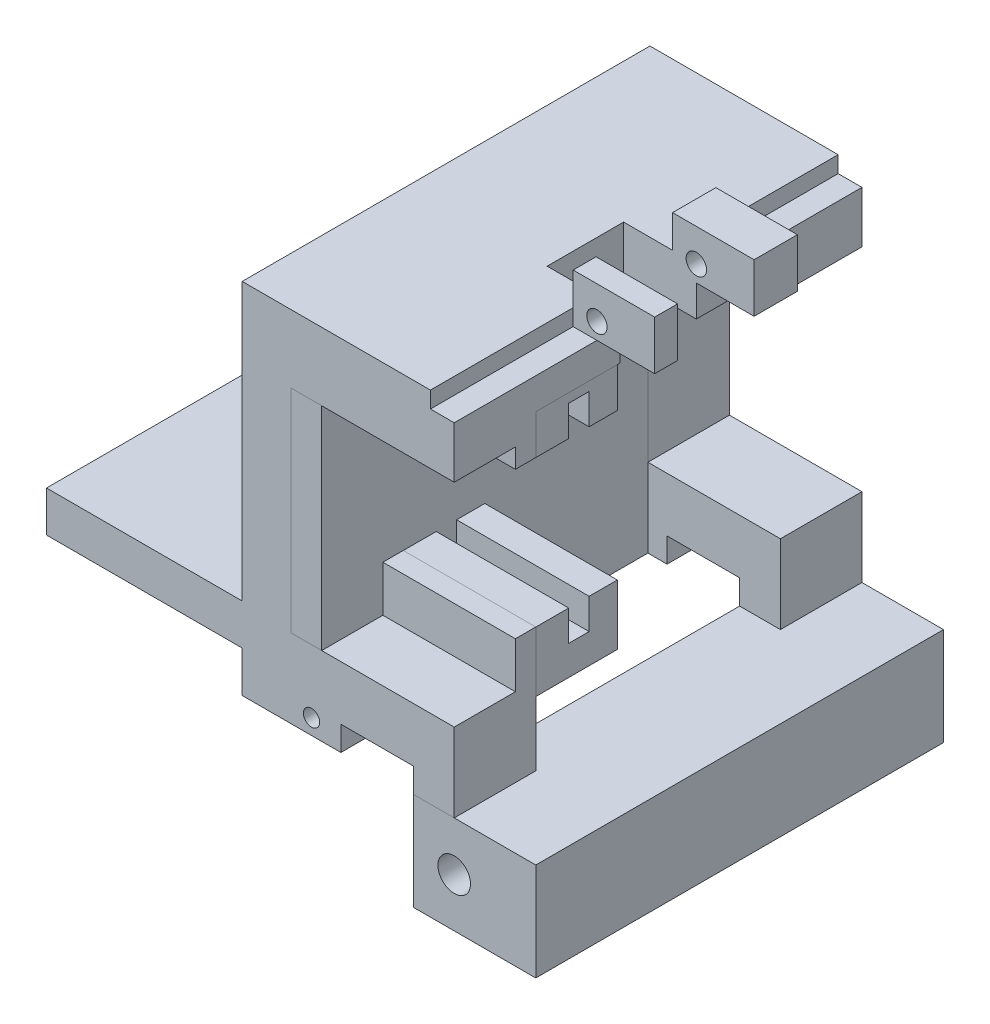
from build123d import *

# Parameters (mm, degrees)
SKETCH8_R                = 1.27
BOSS_EXTRUDE3_DEPTH      = 101.6
SKETCH40_W               = 25.4
SKETCH40_H               = 38.1
CUT_EXTRUDE24_DEPTH      = 50.8
CUT_EXTRUDE11_DEPTH      = 130.327883255
CUT_EXTRUDE11_DEPTH_BACK = 101.6
SKETCH18_W               = 33.02
SKETCH18_H               = 2.3622
BOSS_EXTRUDE4_DEPTH      = 101.6
CUT_EXTRUDE12_START      = -101.6
SKETCH20_R               = 1.5875
CUT_EXTRUDE12_DEPTH      = 101.6
SKETCH21_W               = 33.02
SKETCH21_H               = 19.05
CUT_EXTRUDE13_DEPTH      = 135.416648809
SKETCH24_W               = 8.993546066
SKETCH24_H               = 19.05
CUT_EXTRUDE15_DEPTH      = 135.416648809
SKETCH38_W               = 11.9126
SKETCH38_H               = 7.635884817
CUT_EXTRUDE21_DEPTH      = 20.32
SKETCH41_W               = 30.48
SKETCH41_H               = 19.05
CUT_EXTRUDE25_DEPTH      = 130.137479387
SKETCH43_W               = 12.7
SKETCH43_H               = 33.02
CUT_EXTRUDE26_DEPTH      = 25.4
SKETCH44_W               = 3.175
SKETCH44_H               = 3.0226
SKETCH44_H_2             = 7.1501
BOSS_EXTRUDE5_DEPTH      = 25.4
BOSS_EXTRUDE6_DEPTH      = 25.4
BOSS_EXTRUDE6_2_DEPTH    = 25.4
SKETCH46_R               = 2.54
BOSS_EXTRUDE7_DEPTH      = 63.5
CUT_EXTRUDE29_DEPTH      = 105.670466108
CUT_EXTRUDE29_DEPTH_BACK = 12.7
SKETCH49_W               = 11.303
SKETCH49_H               = 3.81
CUT_EXTRUDE31_DEPTH      = 12.7
SKETCH50_W               = 11.326453934
SKETCH50_H               = 11.9126
CUT_EXTRUDE33_DEPTH      = 4.8768
BOSS_EXTRUDE8_DEPTH      = 4.7625
SKETCH53_W               = 22.225
SKETCH53_H               = 7.635884817
CUT_EXTRUDE34_DEPTH      = 12.7
SKETCH54_W               = 19.05
SKETCH54_H               = 7.635884817
CUT_EXTRUDE35_DEPTH      = 12.7
SKETCH56_W               = 12.7
SKETCH56_H               = 33.02
CUT_EXTRUDE36_DEPTH      = 20.6375


with BuildPart() as part:
    # Sketch8 → Boss-Extrude3 (new body)
    with BuildSketch(Plane.XY):
        Polygon((0, 0), (0, 48.6918), (-33.02, 48.6918), (-33.02, 5.588), (-63.5, 5.588), (-63.5, -0.762), (-33.02, -0.762), (-33.02, -9.525), (-9.525, -9.525), (0, -9.525), align=None)
        with Locations((-15.875, 28.5877)):
            Circle(SKETCH8_R, mode=Mode.SUBTRACT)
        with Locations((-22.225, -4.7625)):
            Circle(SKETCH8_R, mode=Mode.SUBTRACT)
    extrude(amount=BOSS_EXTRUDE3_DEPTH)

    # Sketch40 → Cut-Extrude24 (cut)
    with BuildSketch(Plane.XZ.offset(9.525)):
        with Locations((-12.7, 50.8)):
            Rectangle(SKETCH40_W, SKETCH40_H)
    extrude(amount=-CUT_EXTRUDE24_DEPTH, mode=Mode.SUBTRACT)

    # Sketch18 → Cut-Extrude11 (cut, two sides: drawn at the far end of the back side and taken through both)
    with BuildSketch(Plane.XY.offset(101.6).offset(-CUT_EXTRUDE11_DEPTH_BACK)):
        with Locations((-16.51, -8.3439)):
            Rectangle(SKETCH18_W, SKETCH18_H)
    extrude(amount=CUT_EXTRUDE11_DEPTH + CUT_EXTRUDE11_DEPTH_BACK, mode=Mode.SUBTRACT)

    # Sketch19 → Boss-Extrude4 (add)
    with BuildSketch(Plane(origin=(0, 0, 0), x_dir=(-1, 0, 0), z_dir=(0, 0, -1))):
        with BuildLine():
            Line((1.5875, 48.6918), (3.706453934, 48.6918))
            Line((3.706453934, 48.6918), (3.706453934, 53.7718))
            Line((3.706453934, 53.7718), (-8.993546066, 53.7718))
            Line((-8.993546066, 53.7718), (-8.993546066, 46.135915183))
            Line((-8.993546066, 46.135915183), (0, 46.135915183))
            Line((0, 46.135915183), (0, 47.1043))
            ThreePointArc((0, 47.1043), (-1.122532015, 49.814332015), (1.5875, 48.6918))
        make_face()
    extrude(amount=-BOSS_EXTRUDE4_DEPTH)

    # Sketch20 → Cut-Extrude12 (cut)
    with BuildSketch(Plane.XY.offset(101.6).offset(CUT_EXTRUDE12_START)):
        with Locations(Location((0, 48.6918, 0), (0, 0, 180))):
            Circle(SKETCH20_R)
    extrude(amount=CUT_EXTRUDE12_DEPTH, mode=Mode.SUBTRACT)

    # Sketch21 → Cut-Extrude13 (cut, through all)
    with BuildSketch(Plane.XZ.offset(7.1628)):
        with Locations((-16.51, 92.075)):
            Rectangle(SKETCH21_W, SKETCH21_H)
        with Locations((-16.51, 9.525)):
            Rectangle(SKETCH21_W, SKETCH21_H)
    extrude(amount=-CUT_EXTRUDE13_DEPTH, mode=Mode.SUBTRACT)

    # Sketch24 → Cut-Extrude15 (cut, through all)
    with BuildSketch(Plane(origin=(0, 53.7718, 0), x_dir=(1, 0, 0), z_dir=(0, 1, 0))):
        with Locations((4.496773033, -92.075)):
            Rectangle(SKETCH24_W, SKETCH24_H)
        with Locations((4.496773033, -9.525)):
            Rectangle(SKETCH24_W, SKETCH24_H)
    extrude(amount=-CUT_EXTRUDE15_DEPTH, mode=Mode.SUBTRACT)

    # Sketch38 → Cut-Extrude21 (cut)
    with BuildSketch(Plane(origin=(8.993546066, 0, 0), x_dir=(0, 0, -1), z_dir=(1, 0, 0))):
        with Locations((-50.8, 49.953857592)):
            Rectangle(SKETCH38_W, SKETCH38_H)
    extrude(amount=-CUT_EXTRUDE21_DEPTH, mode=Mode.SUBTRACT)

    # Sketch41 → Cut-Extrude25 (cut, through all)
    with BuildSketch(Plane(origin=(0, 5.588, 0), x_dir=(1, 0, 0), z_dir=(0, 1, 0))):
        with Locations((-48.26, -9.525)):
            Rectangle(SKETCH41_W, SKETCH41_H)
        with Locations((-48.26, -92.075)):
            Rectangle(SKETCH41_W, SKETCH41_H)
    extrude(amount=-CUT_EXTRUDE25_DEPTH, mode=Mode.SUBTRACT)

    # Sketch43 → Cut-Extrude26 (cut)
    with BuildSketch(Plane(origin=(0, 0, 0), x_dir=(0, 0, -1), z_dir=(1, 0, 0))):
        with Locations((-76.2, 21.6027)):
            Rectangle(SKETCH43_W, SKETCH43_H)
    extrude(amount=-CUT_EXTRUDE26_DEPTH, mode=Mode.SUBTRACT)

    # Sketch44 → Boss-Extrude5 (add)
    with BuildSketch(Plane(origin=(-25.4, 0, 0), x_dir=(0, 0, -1), z_dir=(1, 0, 0))):
        with Locations((-71.4375, 36.6014)):
            Rectangle(SKETCH44_W, SKETCH44_H)
        with Locations((-71.4375, 8.66775)):
            Rectangle(SKETCH44_W, SKETCH44_H_2)
    extrude(amount=BOSS_EXTRUDE5_DEPTH)

    # Sketch48 → Cut-Extrude29 (cut, two sides: drawn at the far end of the back side and taken through both)
    with BuildSketch(Plane.XY.offset(82.55).offset(-CUT_EXTRUDE29_DEPTH_BACK)):
        Polygon((-17.653, -184.245390082), (-17.653, -7.1628), (-17.653, -3.346799078), (-6.35, -3.346799078), (-6.35, -7.1628), (-6.35, -184.245390082), (-6.35, -538.410570247), (-17.653, -538.410570247), align=None)
    extrude(amount=CUT_EXTRUDE29_DEPTH + CUT_EXTRUDE29_DEPTH_BACK, mode=Mode.SUBTRACT)

    # Sketch49 → Cut-Extrude31 (cut)
    with BuildSketch(Plane(origin=(0, 0, 19.05), x_dir=(-1, 0, 0), z_dir=(0, 0, -1))):
        with Locations((12.0015, -5.2578)):
            Rectangle(SKETCH49_W, SKETCH49_H)
    extrude(amount=-CUT_EXTRUDE31_DEPTH, mode=Mode.SUBTRACT)

    # Sketch50 → Cut-Extrude33 (cut)
    with BuildSketch(Plane(origin=(0, 46.135915183, 0), x_dir=(1, 0, 0), z_dir=(0, 1, 0))):
        with Locations((-5.663226967, -50.8)):
            Rectangle(SKETCH50_W, SKETCH50_H)
    extrude(amount=-CUT_EXTRUDE33_DEPTH, mode=Mode.SUBTRACT)

    # Sketch53 → Cut-Extrude34 (cut)
    with BuildSketch(Plane(origin=(8.993546066, 0, 0), x_dir=(0, 0, -1), z_dir=(1, 0, 0))):
        with Locations((-71.4375, 49.953857592)):
            Rectangle(SKETCH53_W, SKETCH53_H)
    extrude(amount=-CUT_EXTRUDE34_DEPTH, mode=Mode.SUBTRACT)

    # Sketch54 → Cut-Extrude35 (cut)
    with BuildSketch(Plane(origin=(8.993546066, 0, 0), x_dir=(0, 0, -1), z_dir=(1, 0, 0))):
        with Locations((-28.575, 49.953857592)):
            Rectangle(SKETCH54_W, SKETCH54_H)
    extrude(amount=-CUT_EXTRUDE35_DEPTH, mode=Mode.SUBTRACT)

    # Sketch56 → Cut-Extrude36 (cut)
    with BuildSketch(Plane(origin=(0, 0, 0), x_dir=(0, 0, -1), z_dir=(1, 0, 0))):
        with Locations((-25.4, 21.6027)):
            Rectangle(SKETCH56_W, SKETCH56_H)
    extrude(amount=-CUT_EXTRUDE36_DEPTH, mode=Mode.SUBTRACT)


with BuildPart() as body_2:
    # Sketch45 → Boss-Extrude6 (new body)
    with BuildSketch(Plane(origin=(-25.4, 0, 0), x_dir=(0, 0, -1), z_dir=(1, 0, 0))):
        Polygon((-57.15, 2.8575), (-57.15, 12.2301), (-61.5442, 12.2301), (-61.5442, 7.4676), (-64.7192, 7.4676), (-64.7192, 12.2301), (-69.85, 12.2301), (-69.85, 2.8575), align=None)
    extrude(amount=BOSS_EXTRUDE6_DEPTH)


with BuildPart() as body_3:
    # Sketch45 → Boss-Extrude6 2 (new body)
    with BuildSketch(Plane(origin=(-25.4, 0, 0), x_dir=(0, 0, -1), z_dir=(1, 0, 0))):
        Polygon((-57.15, 35.0901), (-57.15, 41.275), (-69.85, 41.275), (-69.85, 35.0901), (-64.7192, 35.0901), (-64.7192, 39.8526), (-61.5442, 39.8526), (-61.5442, 35.0901), align=None)
    extrude(amount=BOSS_EXTRUDE6_2_DEPTH)


with BuildPart() as body_4:
    # Sketch46 → Boss-Extrude7 (new body)
    with BuildSketch(Plane.XY.offset(82.55)):
        Polygon((12.7, -7.1628), (0, -7.1628), (-6.35, -7.1628), (-6.35, -22.4028), (12.7, -22.4028), align=None)
        with Locations((0, -14.8082)):
            Circle(SKETCH46_R, mode=Mode.SUBTRACT)
    extrude(amount=-BOSS_EXTRUDE7_DEPTH)


with BuildPart() as body_5:
    # Sketch52 → Boss-Extrude8 (new body)
    with BuildSketch(Plane(origin=(-25.4, 0, 0), x_dir=(0, 0, -1), z_dir=(1, 0, 0))):
        Polygon((-73.025, 38.1127), (-82.55, 38.1127), (-82.55, 5.0927), (-73.025, 5.0927), (-73.025, 12.2428), (-64.7192, 12.2301), (-64.7192, 7.4676), (-61.5442, 7.4676), (-61.5442, 12.2301), (-57.15, 12.2301), (-57.15, 2.8575), (-69.85, 2.8575), (-69.85, -7.1628), (-31.75, -7.1628), (-31.75, 41.275), (-57.15, 41.275), (-57.15, 35.0901), (-61.5442, 35.0901), (-61.5442, 39.8526), (-64.7192, 39.8526), (-64.7192, 35.0901), (-73.025, 35.0901), align=None)
    extrude(amount=BOSS_EXTRUDE8_DEPTH)


solid = Compound([part.part, body_2.part, body_3.part, body_4.part, body_5.part])
